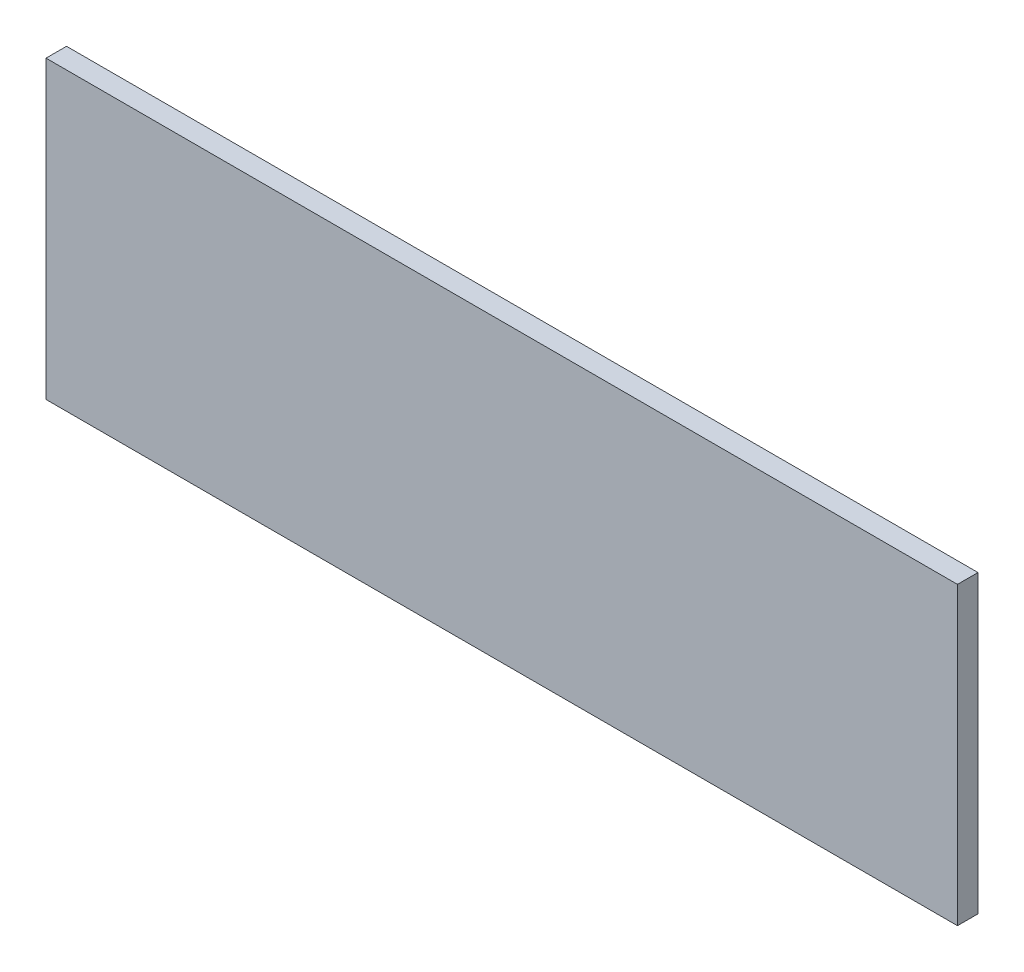
from build123d import *

# Parameters (mm, degrees)
SKETCH1_W           = 70.485
SKETCH1_H           = 22.86
BOSS_EXTRUDE1_DEPTH = 1.5875


with BuildPart() as part:
    # Sketch1 → Boss-Extrude1 (new body)
    with BuildSketch(Plane.XY):
        Rectangle(SKETCH1_W, SKETCH1_H)
    extrude(amount=BOSS_EXTRUDE1_DEPTH)


solid = part.part
